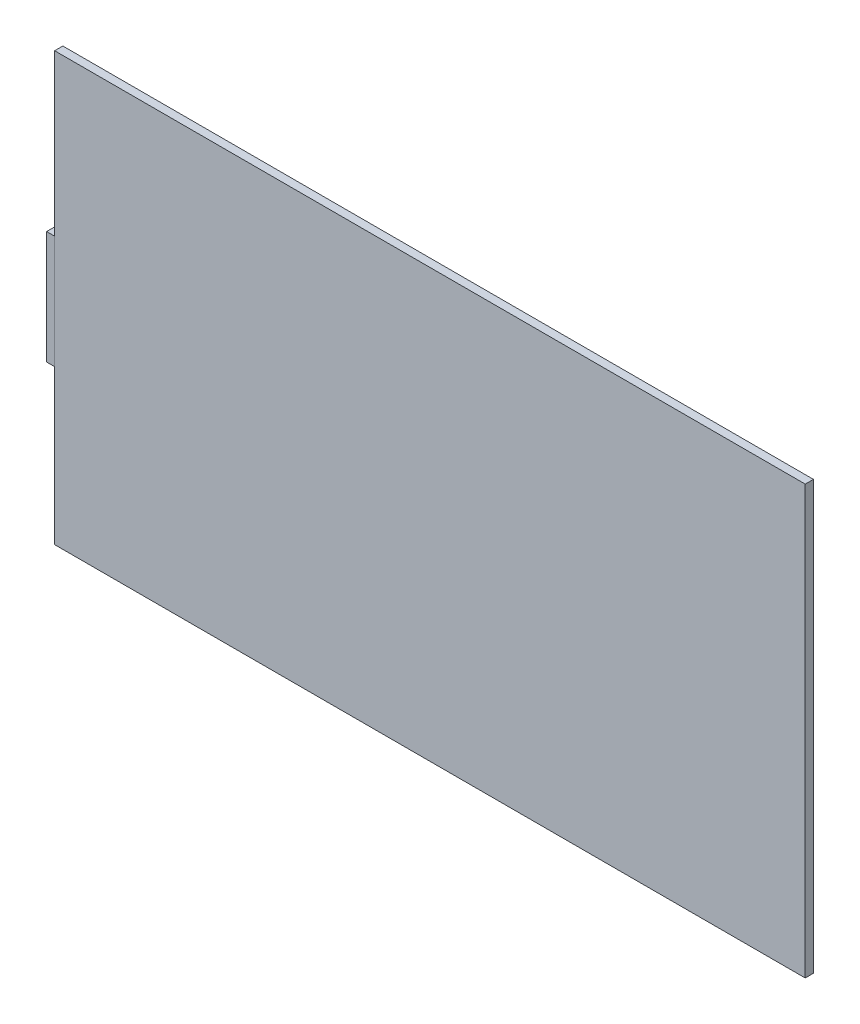
from build123d import *

# Parameters (mm, degrees)
SKETCH1_W           = 93
SKETCH1_H           = 53
BOSS_EXTRUDE1_DEPTH = 1.016
SKETCH2_W           = 1
SKETCH2_H           = 14
BOSS_EXTRUDE2_DEPTH = 1.016


with BuildPart() as part:
    # Sketch1 → Boss-Extrude1 (new body)
    with BuildSketch(Plane.XY):
        with Locations((46.5, 26.5)):
            Rectangle(SKETCH1_W, SKETCH1_H)
    extrude(amount=BOSS_EXTRUDE1_DEPTH)


with BuildPart() as body_2:
    # Sketch2 → Boss-Extrude2 (new body)
    with BuildSketch(Plane.XY.offset(1.016)):
        with Locations((-0.5, 26.1)):
            Rectangle(SKETCH2_W, SKETCH2_H)
    extrude(amount=-BOSS_EXTRUDE2_DEPTH)


solid = Compound([part.part, body_2.part])
